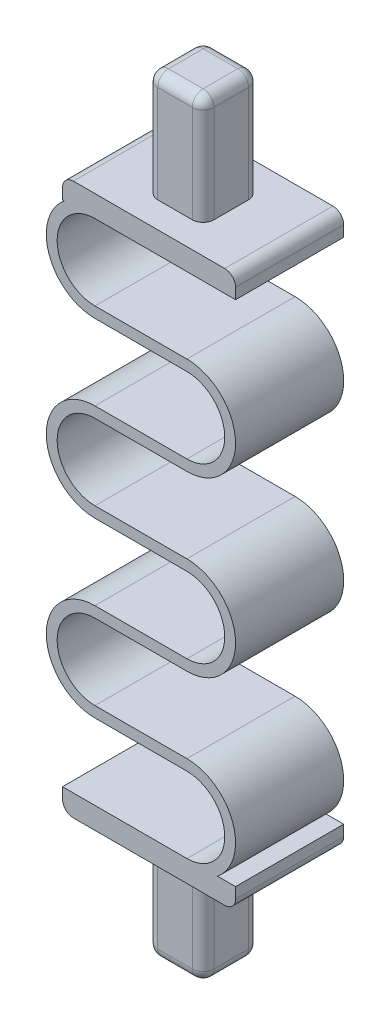
from build123d import *

# Parameters (mm, degrees)
BOSS_EXTRUDE1_DEPTH = 5
SKETCH3_W           = 2.6
SKETCH3_H           = 2.6
BOSS_EXTRUDE2_DEPTH = 5
SKETCH4_W           = 2.6
SKETCH4_H           = 2.6
BOSS_EXTRUDE3_DEPTH = 5
FILLET1_R           = 0.5


with BuildPart() as part:
    # Sketch2 → Boss-Extrude1 (new body)
    with BuildSketch(Plane.XY):
        with BuildLine():
            Line((1.75, -16.137999311), (-4, -16.137999311))
            Line((-4, -16.137999311), (-4, -17.137999311))
            Line((-4, -17.137999311), (4, -17.137999311))
            Line((4, -17.137999311), (4, -16.137999311))
            Line((4, -16.137999311), (3.164213562, -16.137999311))
            ThreePointArc((3.164213562, -16.137999311), (3.871320344, -13.637999311), (1.75, -12.137999311))
            Line((1.75, -12.137999311), (-2.5, -12.137999311))
            ThreePointArc((-2.5, -12.137999311), (-4.25, -10.387999311), (-2.5, -8.637999311))
            Line((-2.5, -8.637999311), (1.75, -8.637999311))
            ThreePointArc((1.75, -8.637999311), (4, -6.387999311), (1.75, -4.137999311))
            Line((1.75, -4.137999311), (-2.5, -4.137999311))
            ThreePointArc((-2.5, -4.137999311), (-4.25, -2.387999311), (-2.5, -0.637999311))
            Line((-2.5, -0.637999311), (1.75, -0.637999311))
            ThreePointArc((1.75, -0.637999311), (4, 1.612000689), (1.75, 3.862000689))
            Line((1.75, 3.862000689), (-2.5, 3.862000689))
            ThreePointArc((-2.5, 3.862000689), (-4.25, 5.612000689), (-2.5, 7.362000689))
            Line((-2.5, 7.362000689), (4, 7.362000689))
            Line((4, 7.362000689), (4, 8.362000689))
            Line((4, 8.362000689), (-4, 8.362000689))
            Line((-4, 8.362000689), (-4, 7.362000689))
            Line((-4, 7.362000689), (-3.914213562, 7.362000689))
            ThreePointArc((-3.914213562, 7.362000689), (-4.621320344, 4.862000689), (-2.5, 3.362000689))
            Line((-2.5, 3.362000689), (1.75, 3.362000689))
            ThreePointArc((1.75, 3.362000689), (3.5, 1.612000689), (1.75, -0.137999311))
            Line((1.75, -0.137999311), (-2.5, -0.137999311))
            ThreePointArc((-2.5, -0.137999311), (-4.75, -2.387999311), (-2.5, -4.637999311))
            Line((-2.5, -4.637999311), (1.75, -4.637999311))
            ThreePointArc((1.75, -4.637999311), (3.5, -6.387999311), (1.75, -8.137999311))
            Line((1.75, -8.137999311), (-2.5, -8.137999311))
            ThreePointArc((-2.5, -8.137999311), (-4.75, -10.387999311), (-2.5, -12.637999311))
            Line((-2.5, -12.637999311), (1.75, -12.637999311))
            ThreePointArc((1.75, -12.637999311), (3.5, -14.387999311), (1.75, -16.137999311))
        make_face()
    extrude(amount=BOSS_EXTRUDE1_DEPTH)

    # Sketch3 → Boss-Extrude2 (add)
    with BuildSketch(Plane(origin=(0, 8.362000689, 0), x_dir=(1, 0, 0), z_dir=(0, 1, 0))):
        with Locations((0, -2.5)):
            Rectangle(SKETCH3_W, SKETCH3_H)
    extrude(amount=BOSS_EXTRUDE2_DEPTH)

    # Sketch4 → Boss-Extrude3 (add)
    with BuildSketch(Plane.XZ.offset(17.137999311)):
        with Locations((0, 2.5)):
            Rectangle(SKETCH4_W, SKETCH4_H)
    extrude(amount=BOSS_EXTRUDE3_DEPTH)

    # Fillet1
    fillet1_edges = [part.edges().sort_by_distance(p)[0] for p in [
        (1.3, 10.862000689, 3.8),
        (1.3, 10.862000689, 1.2),
        (-1.3, 10.862000689, 1.2),
        (-1.3, 10.862000689, 3.8),
        (1.3, 13.362000689, 2.5),
        (0, 13.362000689, 1.2),
        (-1.3, 13.362000689, 2.5),
        (0, 13.362000689, 3.8),
        (-1.3, -19.637999311, 3.8),
        (-1.3, -19.637999311, 1.2),
        (1.3, -19.637999311, 1.2),
        (1.3, -19.637999311, 3.8),
        (-1.3, -22.137999311, 2.5),
        (0, -22.137999311, 1.2),
        (1.3, -22.137999311, 2.5),
        (0, -22.137999311, 3.8),
        (-4, 8.362000689, 2.5),
        (4, 8.362000689, 2.5),
        (4, -17.137999311, 2.5),
        (-4, -17.137999311, 2.5),
    ]]
    fillet(fillet1_edges, radius=FILLET1_R)


solid = part.part
